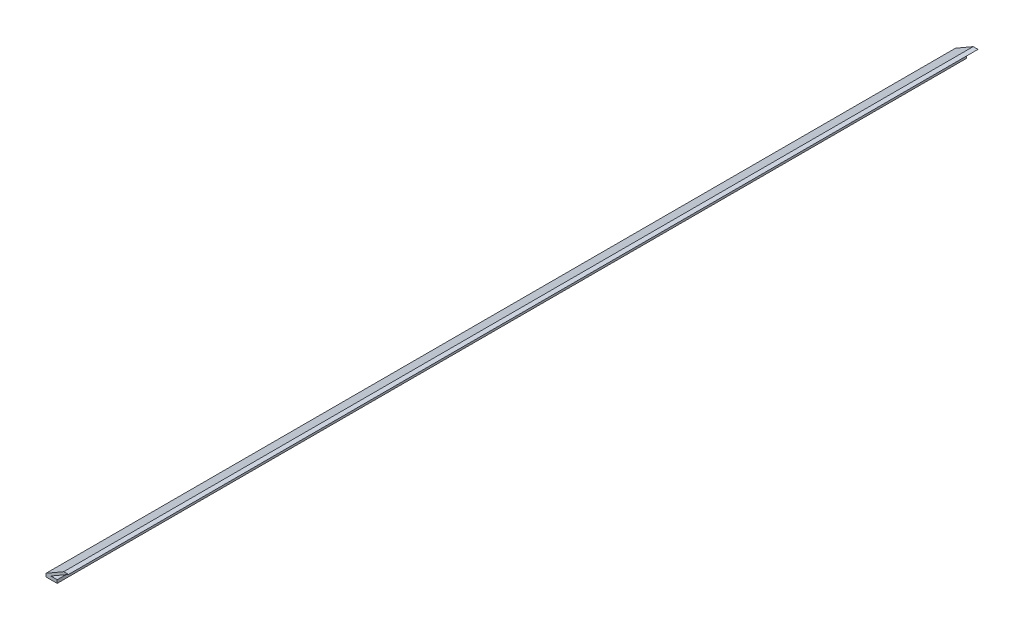
from build123d import *

# Parameters (mm, degrees)
BOSS_EXTRU_1_DEPTH      = 2850
ESQUISSE3_R             = 4
ENL_V_MAT_EXTRU_1_DEPTH = 10


with BuildPart() as part:
    # Esquisse1 → Boss.-Extru.1 (new body)
    with BuildSketch(Plane.XY):
        Polygon((-12, -79.697824129), (23, -79.697824129), (23, -69.697824129), (3, -69.697824129), (58.522190754, -37.642072351), (43.522190754, -37.642072351), (-12, -69.697824129), align=None)
    extrude(amount=BOSS_EXTRU_1_DEPTH)

    # Esquisse3 → Enlèv. mat.-Extru.1 (cut)
    with BuildSketch(Plane.XZ.offset(79.697824129)):
        with Locations(Location((14, 90, 0), (0, 0, 270))):
            Circle(ESQUISSE3_R)
        with Locations(Location((14, 290, 0), (0, 0, 270))):
            Circle(ESQUISSE3_R)
        with Locations(Location((14, 490, 0), (0, 0, 270))):
            Circle(ESQUISSE3_R)
        with Locations(Location((14, 690, 0), (0, 0, 270))):
            Circle(ESQUISSE3_R)
        with Locations(Location((14, 890, 0), (0, 0, 270))):
            Circle(ESQUISSE3_R)
        with Locations(Location((14, 1090, 0), (0, 0, 270))):
            Circle(ESQUISSE3_R)
        with Locations(Location((14, 1290, 0), (0, 0, 270))):
            Circle(ESQUISSE3_R)
        with Locations(Location((14, 1490, 0), (0, 0, 270))):
            Circle(ESQUISSE3_R)
        with Locations(Location((14, 1690, 0), (0, 0, 270))):
            Circle(ESQUISSE3_R)
        with Locations(Location((14, 1890, 0), (0, 0, 270))):
            Circle(ESQUISSE3_R)
        with Locations(Location((14, 2090, 0), (0, 0, 270))):
            Circle(ESQUISSE3_R)
        with Locations(Location((14, 2290, 0), (0, 0, 270))):
            Circle(ESQUISSE3_R)
        with Locations(Location((14, 2490, 0), (0, 0, 270))):
            Circle(ESQUISSE3_R)
        with Locations(Location((14, 2690, 0), (0, 0, 270))):
            Circle(ESQUISSE3_R)
    extrude(amount=-ENL_V_MAT_EXTRU_1_DEPTH, mode=Mode.SUBTRACT)


solid = part.part
